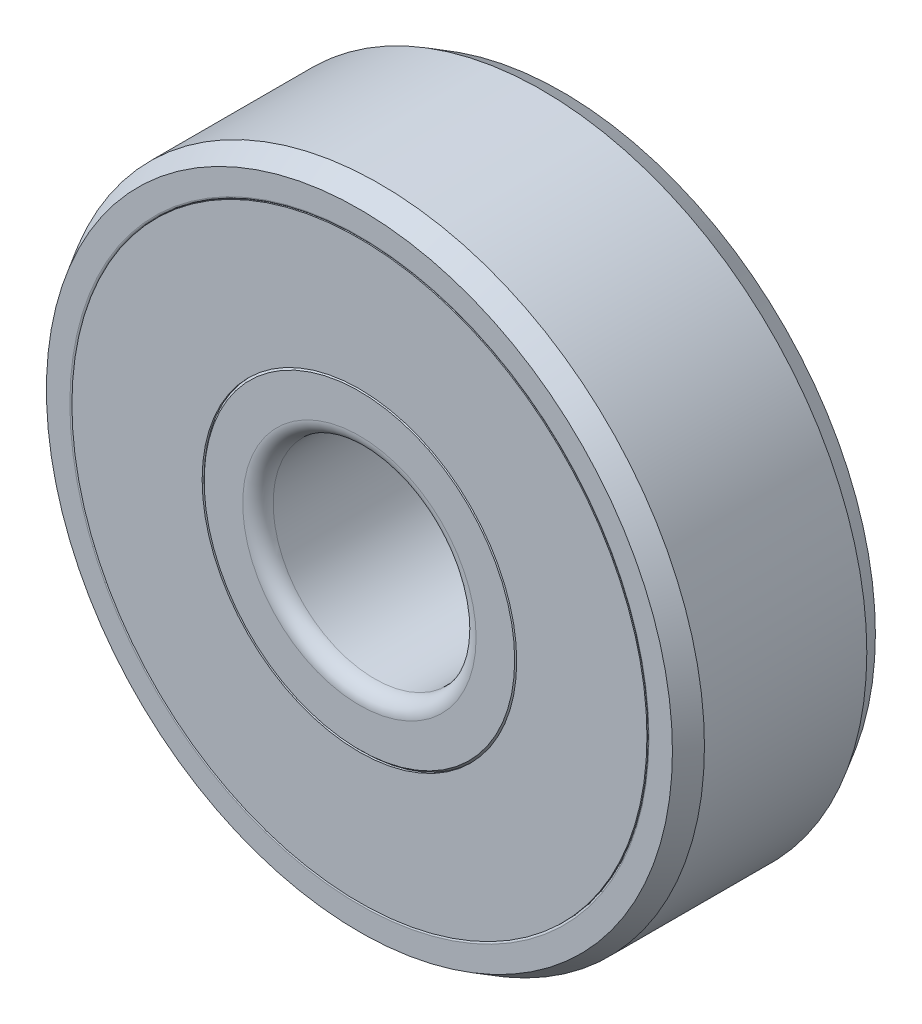
from build123d import *

# Parameters (mm, degrees)
SKETCH4_W         = 0.213541667
SKETCH4_H         = 3.208333333
CIRPATTERN1_COUNT = 7


with BuildPart() as part:
    # Sketch3 → Revolve1 (revolve)
    with BuildSketch(Plane(origin=(0, 0, 0), x_dir=(0, 0, -1), z_dir=(1, 0, 0))):
        with BuildLine():
            Line((-2, -8), (2, -8))
            Line((2, -8), (2.5, -7.711324865))
            Line((2.5, -7.711324865), (2.5, -7.133333333))
            ThreePointArc((2.5, -7.133333333), (2.485355339, -7.097977994), (2.45, -7.083333333))
            Line((2.45, -7.083333333), (1.527777778, -7.083333333))
            ThreePointArc((1.527777778, -7.083333333), (0, -7.694444444), (-1.527777778, -7.083333333))
            Line((-1.527777778, -7.083333333), (-2.45, -7.083333333))
            ThreePointArc((-2.45, -7.083333333), (-2.485355339, -7.097977994), (-2.5, -7.133333333))
            Line((-2.5, -7.133333333), (-2.5, -7.711324865))
            Line((-2.5, -7.711324865), (-2, -8))
        make_face()
        with BuildLine():
            Line((-2.125, -2.5), (2.125, -2.5))
            ThreePointArc((2.125, -2.5), (2.390165043, -2.609834957), (2.5, -2.875))
            Line((2.5, -2.875), (2.5, -3.825))
            Line((2.5, -3.825), (2.45, -3.875))
            Line((2.45, -3.875), (1.527777778, -3.875))
            ThreePointArc((1.527777778, -3.875), (0, -3.263888889), (-1.527777778, -3.875))
            Line((-1.527777778, -3.875), (-2.45, -3.875))
            Line((-2.45, -3.875), (-2.5, -3.825))
            Line((-2.5, -3.825), (-2.5, -2.875))
            ThreePointArc((-2.5, -2.875), (-2.390165043, -2.609834957), (-2.125, -2.5))
        make_face()
    revolve(axis=Axis((0, 0, 2.5), (0, 0, -1)))


with BuildPart() as body_2:
    # Sketch4 → Revolve2 (revolve)
    with BuildSketch(Plane(origin=(0, 0, 0), x_dir=(0, 0, -1), z_dir=(1, 0, 0))):
        with Locations((-2.393229167, -5.479166667)):
            Rectangle(SKETCH4_W, SKETCH4_H)
    revolve(axis=Axis((0, 0, 2.5), (0, 0, -1)))


with BuildPart() as body_3:
    # Sketch5 → Revolve3 (revolve)
    with BuildSketch(Plane(origin=(0, 0, 0), x_dir=(0, 0, -1), z_dir=(1, 0, 0))):
        with BuildLine():
            Line((0, -3.263888889), (0, -7.694444444))
            ThreePointArc((0, -7.694444444), (-2.215277778, -5.479166667), (0, -3.263888889))
        make_face()
    revolve(axis=Axis((0, 0, 0), (0, -1, 0)))


with BuildPart() as cirpattern1_1:
    # CirPattern1: pattern copy
    add(body_3.part.rotate(Axis((0, 0, 2.5), (0, 0, -1)), 1 * 360 / CIRPATTERN1_COUNT))


with BuildPart() as cirpattern1_2:
    # CirPattern1: pattern copy
    add(body_3.part.rotate(Axis((0, 0, 2.5), (0, 0, -1)), 2 * 360 / CIRPATTERN1_COUNT))


with BuildPart() as cirpattern1_3:
    # CirPattern1: pattern copy
    add(body_3.part.rotate(Axis((0, 0, 2.5), (0, 0, -1)), 3 * 360 / CIRPATTERN1_COUNT))


with BuildPart() as cirpattern1_4:
    # CirPattern1: pattern copy
    add(body_3.part.rotate(Axis((0, 0, 2.5), (0, 0, -1)), 4 * 360 / CIRPATTERN1_COUNT))


with BuildPart() as cirpattern1_5:
    # CirPattern1: pattern copy
    add(body_3.part.rotate(Axis((0, 0, 2.5), (0, 0, -1)), 5 * 360 / CIRPATTERN1_COUNT))


with BuildPart() as cirpattern1_6:
    # CirPattern1: pattern copy
    add(body_3.part.rotate(Axis((0, 0, 2.5), (0, 0, -1)), 6 * 360 / CIRPATTERN1_COUNT))


solid = Compound([part.part, body_2.part, body_3.part, cirpattern1_1.part, cirpattern1_2.part, cirpattern1_3.part, cirpattern1_4.part, cirpattern1_5.part, cirpattern1_6.part])
